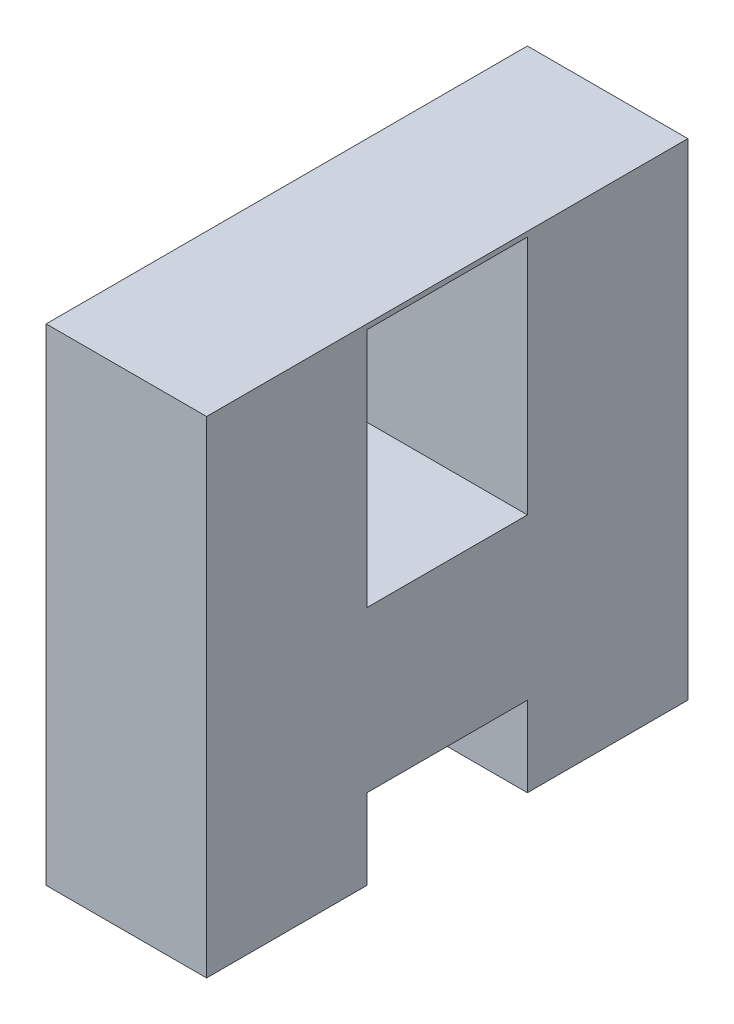
from build123d import *

# Parameters (mm, degrees)
SKETCH2_W           = 101.6
SKETCH2_H           = 152.4
BOSS_EXTRUDE1_DEPTH = 101.6


with BuildPart() as part:
    # Sketch2 → Boss-Extrude1 (new body)
    with BuildSketch(Plane(origin=(0, 0, 0), x_dir=(0, 0, -1), z_dir=(1, 0, 0))):
        Polygon((0, 307.975), (0, 0), (101.6, 0), (101.6, 50.8), (203.2, 50.8), (203.2, 0), (304.8, 0), (304.8, 307.975), align=None)
        with Locations((152.4, 228.6)):
            Rectangle(SKETCH2_W, SKETCH2_H, mode=Mode.SUBTRACT)
    extrude(amount=BOSS_EXTRUDE1_DEPTH)


solid = part.part
